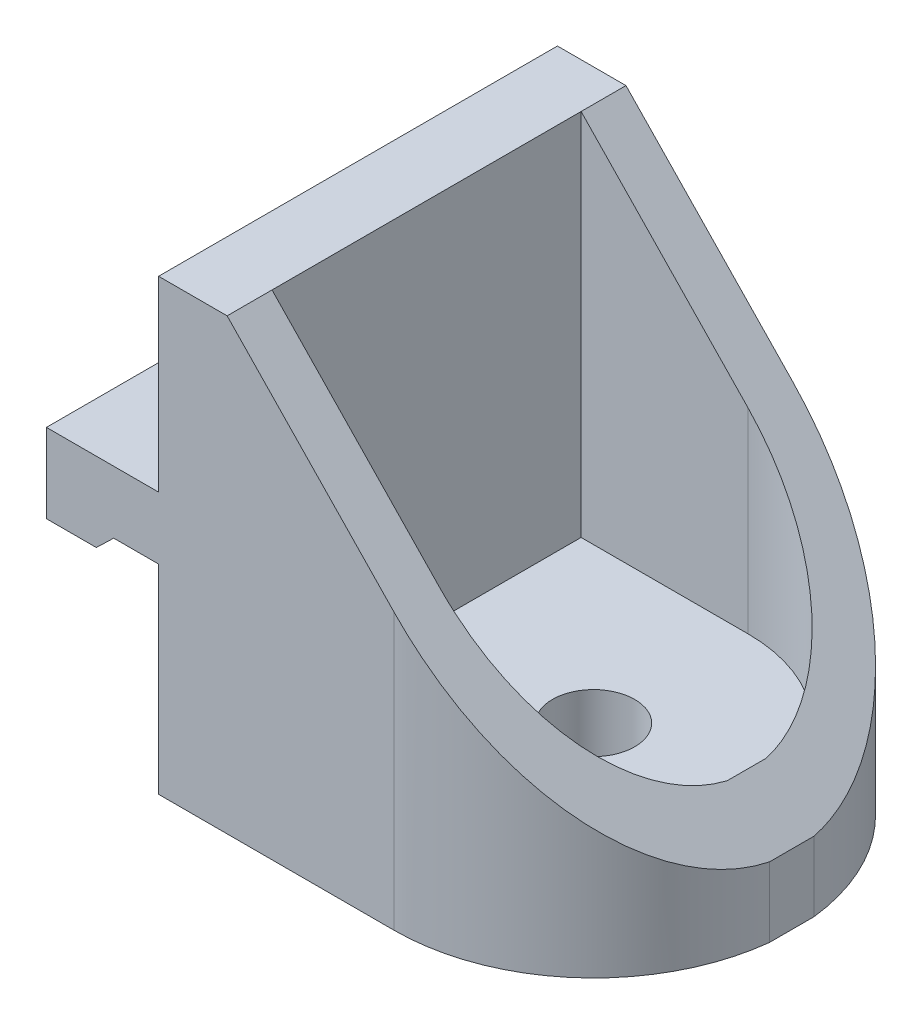
from build123d import *

# Parameters (mm, degrees)
BOSS_EXTRUDE1_DEPTH = 16
CUT_EXTRUDE1_DEPTH  = 49.274320296
CUT_EXTRUDE2_START  = 6.4
CUT_EXTRUDE2_DEPTH  = 42.874320296
SKETCH4_R           = 3.298649114
CUT_EXTRUDE3_DEPTH  = 49.274320296


with BuildPart() as part:
    # Sketch1 → Boss-Extrude1 (new, symmetric)
    with BuildSketch(Plane.XY):
        Polygon((15.9, 0), (-18.9, 0), (-18.9, 16), (-22.5, 16), (-23.9, 14.650657895), (-27.9, 14.650657895), (-27.9, 21), (-18.9, 21), (-18.9, 36), (-13.4, 36), (15.9, 5.6), align=None)
    extrude(amount=BOSS_EXTRUDE1_DEPTH, both=True)

    # Sketch2 → Cut-Extrude1 (cut, through all)
    with BuildSketch(Plane.XZ):
        with BuildLine():
            Line((0, 16), (0, 22.397200509))
            Line((0, 22.397200509), (24.633267537, 22.397200509))
            Line((24.633267537, 22.397200509), (24.633267537, -22.936337669))
            Line((24.633267537, -22.936337669), (0, -22.936337669))
            Line((0, -22.936337669), (0, -16))
            ThreePointArc((0, -16), (16, 0), (0, 16))
        make_face()
    extrude(amount=-CUT_EXTRUDE1_DEPTH, mode=Mode.SUBTRACT)

    # Sketch3 → Cut-Extrude2 (cut, through all)
    with BuildSketch(Plane(origin=(0, 0, 0), x_dir=(1, 0, 0), z_dir=(0, 1, 0)).offset(CUT_EXTRUDE2_START)):
        with BuildLine():
            Line((-13.4, -12.4), (-13.4, 12.4))
            Line((-13.4, 12.4), (0, 12.4))
            ThreePointArc((0, 12.4), (8.193652125, 9.307204997), (12.3, 1.571623365))
            Line((12.3, 1.571623365), (12.3, -1.571623365))
            ThreePointArc((12.3, -1.571623365), (8.193652125, -9.307204997), (0, -12.4))
            Line((0, -12.4), (-13.4, -12.4))
        make_face()
    extrude(amount=CUT_EXTRUDE2_DEPTH, mode=Mode.SUBTRACT)

    # Sketch4 → Cut-Extrude3 (cut, through all)
    with BuildSketch(Plane(origin=(0, 0, 0), x_dir=(1, 0, 0), z_dir=(0, 1, 0))):
        with Locations(Location((0, 0, 0), (0, 0, 270))):
            Circle(SKETCH4_R)
    extrude(amount=CUT_EXTRUDE3_DEPTH, mode=Mode.SUBTRACT)


solid = part.part
